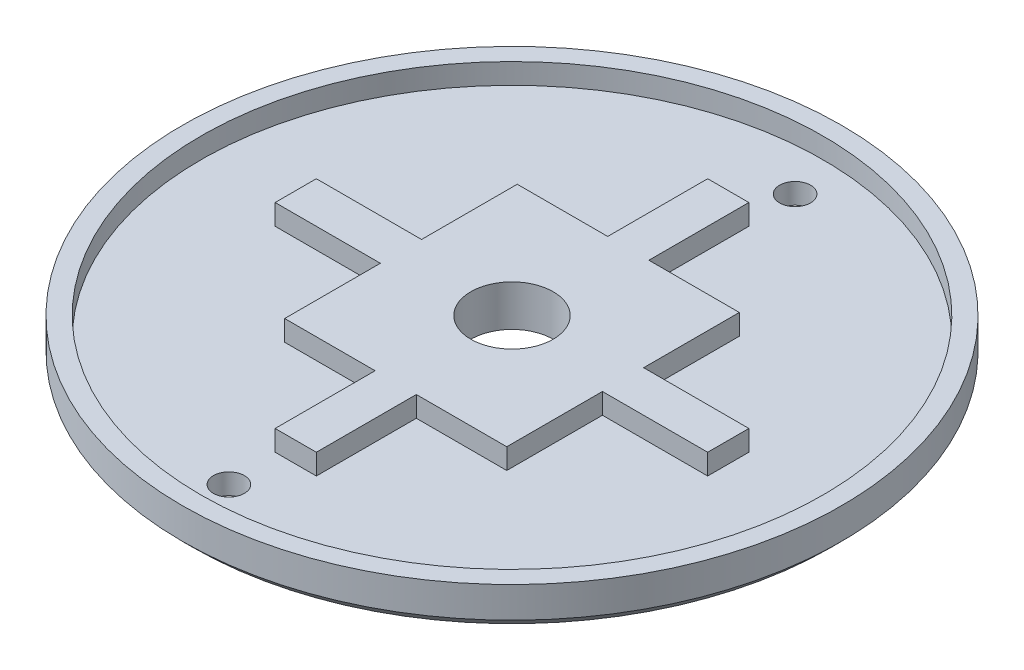
from build123d import *

# Parameters (mm, degrees)
SKETCH1_R           = 32
BOSS_EXTRUDE1_DEPTH = 4
SKETCH2_R           = 30.2
CUT_EXTRUDE1_DEPTH  = 2
CHAMFER1_SIZE       = 1
SKETCH3_R           = 1.5
CUT_EXTRUDE2_DEPTH  = 15
SKETCH5_W           = 4
SKETCH5_H           = 42
SKETCH5_W_2         = 42
SKETCH5_H_2         = 4
BOSS_EXTRUDE2_DEPTH = 2
SKETCH6_R           = 4
CUT_EXTRUDE3_DEPTH  = 10
SKETCH7_W           = 15
SKETCH7_H           = 20
CUT_EXTRUDE4_DEPTH  = 10
BOSS_EXTRUDE3_START = 2
SKETCH8_W           = 21.56425071
SKETCH8_H           = 22.582305464
SKETCH8_R           = 4
BOSS_EXTRUDE3_DEPTH = 2


with BuildPart() as part:
    # Sketch1 → Boss-Extrude1 (new body)
    with BuildSketch(Plane(origin=(0, 0, 0), x_dir=(1, 0, 0), z_dir=(0, 1, 0))):
        with Locations(Location((0, 0, 0), (0, 0, 270))):
            Circle(SKETCH1_R)
    extrude(amount=BOSS_EXTRUDE1_DEPTH)

    # Sketch2 → Cut-Extrude1 (cut)
    with BuildSketch(Plane(origin=(0, 4, 0), x_dir=(1, 0, 0), z_dir=(0, 1, 0))):
        with Locations(Location((0, 0, 0), (0, 0, 270))):
            Circle(SKETCH2_R)
    extrude(amount=-CUT_EXTRUDE1_DEPTH, mode=Mode.SUBTRACT)

    # Chamfer1
    chamfer1_edges = [part.edges().sort_by_distance(p)[0] for p in [
        (0, 0, -32),
    ]]
    chamfer(chamfer1_edges, length=CHAMFER1_SIZE)

    # Sketch3 → Cut-Extrude2 (cut)
    with BuildSketch(Plane.XZ):
        with Locations(Location((-1.532005462, 25.954825356, 0), (0, 0, 270))):
            Circle(SKETCH3_R)
        with Locations(Location((1.532016667, -25.954824695, 0), (0, 0, 270))):
            Circle(SKETCH3_R)
    extrude(amount=-CUT_EXTRUDE2_DEPTH, mode=Mode.SUBTRACT)

    # Sketch5 → Boss-Extrude2 (add)
    with BuildSketch(Plane(origin=(0, 2, 0), x_dir=(1, 0, 0), z_dir=(0, 1, 0))):
        Rectangle(SKETCH5_W, SKETCH5_H)
        Rectangle(SKETCH5_W_2, SKETCH5_H_2)
    extrude(amount=BOSS_EXTRUDE2_DEPTH)

    # Sketch6 → Cut-Extrude3 (cut)
    with BuildSketch(Plane(origin=(0, 4, 0), x_dir=(1, 0, 0), z_dir=(0, 1, 0))):
        with Locations(Location((0, 0, 0), (0, 0, 270))):
            Circle(SKETCH6_R)
    extrude(amount=-CUT_EXTRUDE3_DEPTH, mode=Mode.SUBTRACT)

    # Sketch7 → Cut-Extrude4 (cut)
    with BuildSketch(Plane(origin=(0, 2, 0), x_dir=(1, 0, 0), z_dir=(0, 1, 0))):
        Rectangle(SKETCH7_W, SKETCH7_H)
    extrude(amount=CUT_EXTRUDE4_DEPTH, mode=Mode.SUBTRACT)

    # Sketch8 → Boss-Extrude3 (add)
    with BuildSketch(Plane(origin=(0, 2, 0), x_dir=(1, 0, 0), z_dir=(0, 1, 0)).offset(BOSS_EXTRUDE3_START)):
        Rectangle(SKETCH8_W, SKETCH8_H)
        with Locations(Location((0, 0, 0), (0, 0, 270))):
            Circle(SKETCH8_R, mode=Mode.SUBTRACT)
    extrude(amount=-BOSS_EXTRUDE3_DEPTH)


solid = part.part
